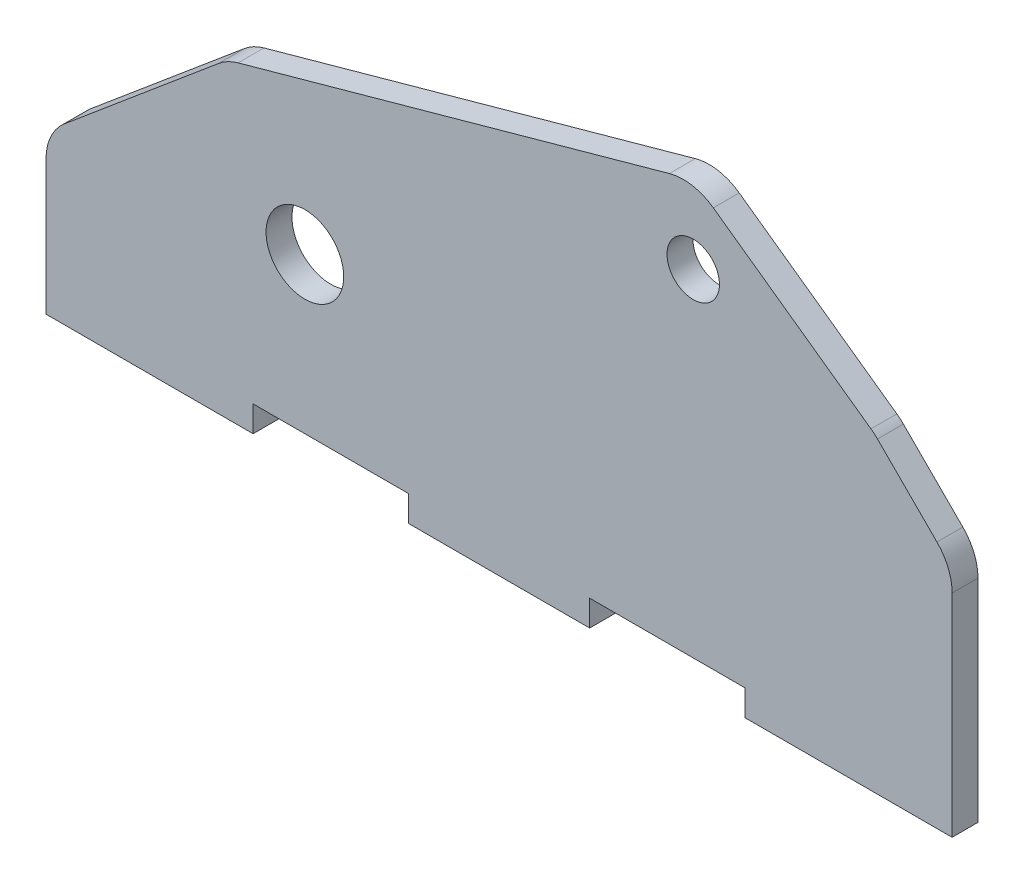
from build123d import *

# Parameters (mm, degrees)
ESQUISSE1_R        = 15
ESQUISSE1_R_2      = 10.125
BOSS_EXTRU_1_DEPTH = 10
CONG_1_R           = 20


with BuildPart() as part:
    # Esquisse1 → Boss.-Extru.1 (new body)
    with BuildSketch(Plane.XY):
        Polygon((350, 0), (350, 90), (320, 120), (250, 170), (70, 120), (0, 61.263025818), (0, 0), (80, 0), (80, 10), (140, 10), (140, 0), (210, 0), (210, 10), (270, 10), (270, 0), align=None)
        with Locations((100, 70)):
            Circle(ESQUISSE1_R, mode=Mode.SUBTRACT)
        with Locations((250, 140)):
            Circle(ESQUISSE1_R_2, mode=Mode.SUBTRACT)
    extrude(amount=BOSS_EXTRU_1_DEPTH)

    # Congé1
    cong_1_edges = [part.edges().sort_by_distance(p)[0] for p in [
        (0, 61.263025818, 5),
        (70, 120, 5),
        (250, 170, 5),
        (320, 120, 5),
        (350, 90, 5),
    ]]
    fillet(cong_1_edges, radius=CONG_1_R)


solid = part.part
